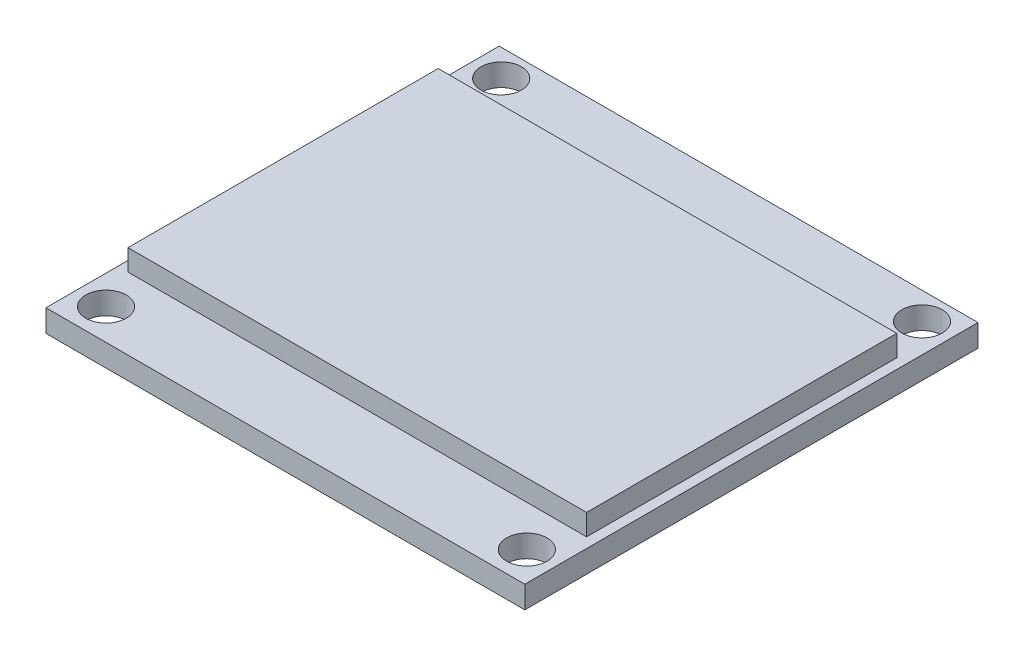
from build123d import *

# Parameters (mm, degrees)
SKETCH1_W           = 35.5
SKETCH1_H           = 33.6
SKETCH1_R           = 1.5
BOSS_EXTRUDE1_DEPTH = 1.65
SKETCH2_W           = 34
SKETCH2_H           = 23
BOSS_EXTRUDE2_DEPTH = 1.57


with BuildPart() as part:
    # Sketch1 → Boss-Extrude1 (new body)
    with BuildSketch(Plane(origin=(0, 0, 0), x_dir=(1, 0, 0), z_dir=(0, 1, 0))):
        with Locations((0.870728929, -4.806833713)):
            Rectangle(SKETCH1_W, SKETCH1_H)
        with Locations(Location((-14.729271071, 9.993166287, 0), (0, 0, 270))):
            Circle(SKETCH1_R, mode=Mode.SUBTRACT)
        with Locations(Location((16.470728929, 9.993166287, 0), (0, 0, 270))):
            Circle(SKETCH1_R, mode=Mode.SUBTRACT)
        with Locations(Location((-14.729271071, -19.306833713, 0), (0, 0, 270))):
            Circle(SKETCH1_R, mode=Mode.SUBTRACT)
        with Locations(Location((16.470728929, -19.306833713, 0), (0, 0, 270))):
            Circle(SKETCH1_R, mode=Mode.SUBTRACT)
    extrude(amount=BOSS_EXTRUDE1_DEPTH)

    # Sketch2 → Boss-Extrude2 (add)
    with BuildSketch(Plane(origin=(0, 1.65, 0), x_dir=(1, 0, 0), z_dir=(0, 1, 0))):
        with Locations((0.870728929, -4.776833713)):
            Rectangle(SKETCH2_W, SKETCH2_H)
    extrude(amount=BOSS_EXTRUDE2_DEPTH)


solid = part.part
